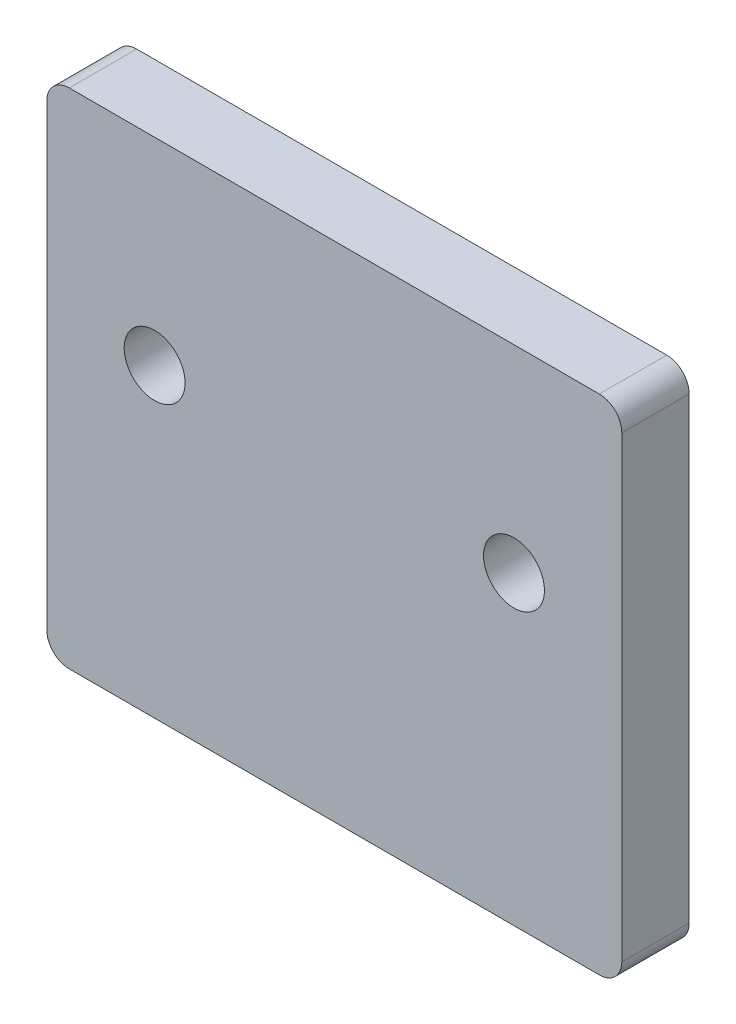
from build123d import *

# Parameters (mm, degrees)
SKETCH1_R           = 2.15265
BOSS_EXTRUDE1_DEPTH = 4.7625


with BuildPart() as part:
    # Sketch1 → Boss-Extrude1 (new body)
    with BuildSketch(Plane.XY):
        with BuildLine():
            Line((0, 1.5875), (0, 33.9725))
            ThreePointArc((0, 33.9725), (-0.464967985, 35.095032015), (-1.5875, 35.56))
            Line((-1.5875, 35.56), (-39.0525, 35.56))
            ThreePointArc((-39.0525, 35.56), (-40.175032015, 35.095032015), (-40.64, 33.9725))
            Line((-40.64, 33.9725), (-40.64, 1.5875))
            ThreePointArc((-40.64, 1.5875), (-40.175032015, 0.464967985), (-39.0525, 0))
            Line((-39.0525, 0), (-1.5875, 0))
            ThreePointArc((-1.5875, 0), (-0.464967985, 0.464967985), (0, 1.5875))
        make_face()
        with Locations(Location((-7.62, 21.59, 0), (0, 0, 180))):
            Circle(SKETCH1_R, mode=Mode.SUBTRACT)
        with Locations(Location((-33.02, 21.59, 0), (0, 0, 180))):
            Circle(SKETCH1_R, mode=Mode.SUBTRACT)
    extrude(amount=BOSS_EXTRUDE1_DEPTH)


solid = part.part
